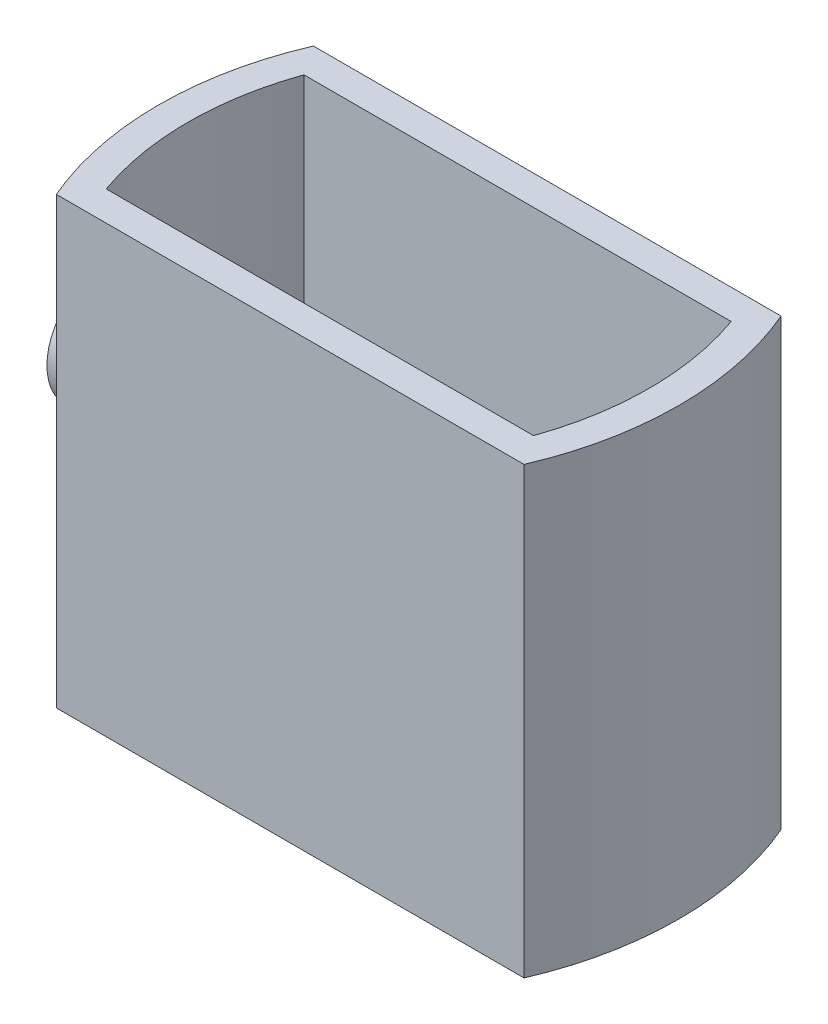
from build123d import *

# Parameters (mm, degrees)
SALIENTE_EXTRUIR1_DEPTH      = 45
SALIENTE_EXTRUIR2_DEPTH      = 3
SALIENTE_EXTRUIR3_REACH      = 75.192
SALIENTE_EXTRUIR3_END_RADIUS = 33
CROQUIS3_R                   = 6
SALIENTE_EXTRUIR4_START      = 5
CROQUIS4_R                   = 6
SALIENTE_EXTRUIR4_DEPTH      = 5
CROQUIS5_R                   = 3
CORTAR_EXTRUIR1_DEPTH        = 12


with BuildPart() as part:
    # Croquis1 → Saliente-Extruir1 (new body)
    with BuildSketch(Plane(origin=(0, 0, 0), x_dir=(1, 0, 0), z_dir=(0, 1, 0))):
        with BuildLine():
            Line((2.952769471, -3), (50.275773024, -3))
            ThreePointArc((50.275773024, -3), (52.944271247, 10), (50.275773024, 23))
            Line((50.275773024, 23), (2.952769471, 23))
            ThreePointArc((2.952769471, 23), (0.284271247, 10), (2.952769471, -3))
        make_face()
        with BuildLine():
            Line((5, 0), (48.228542495, 0))
            ThreePointArc((48.228542495, 0), (49.944271247, 10), (48.228542495, 20))
            Line((48.228542495, 20), (5, 20))
            ThreePointArc((5, 20), (3.284271247, 10), (5, 0))
        make_face(mode=Mode.SUBTRACT)
    extrude(amount=SALIENTE_EXTRUIR1_DEPTH)

    # Croquis2 → Saliente-Extruir2 (add)
    with BuildSketch(Plane.XZ):
        with BuildLine():
            Line((2.952769471, 3), (50.275773024, 3))
            ThreePointArc((50.275773024, 3), (52.944271247, -10), (50.275773024, -23))
            Line((50.275773024, -23), (2.952769471, -23))
            ThreePointArc((2.952769471, -23), (0.284271247, -10), (2.952769471, 3))
        make_face()
        with BuildLine():
            Line((15.114271247, -20), (38.114271247, -20))
            ThreePointArc((38.114271247, -20), (39.409874114, -10), (38.114271247, 0))
            Line((38.114271247, 0), (15.114271247, 0))
            ThreePointArc((15.114271247, 0), (13.398542495, -10), (15.114271247, -20))
        make_face(mode=Mode.SUBTRACT)
    extrude(amount=-SALIENTE_EXTRUIR2_DEPTH)

    # Saliente-Extruir3: up to this cylinder (the profile starts outside it)
    saliente_extruir3_end = Plane(origin=(33.284271247, 22.52988, -10), z_dir=(0, -1, 0)) * Cylinder(SALIENTE_EXTRUIR3_END_RADIUS, 217.384, mode=Mode.PRIVATE)
    # Croquis3 → Saliente-Extruir3 (add, up to the surface)
    with BuildSketch(Plane(origin=(0, 0, 0), x_dir=(0, 0, -1), z_dir=(1, 0, 0)), mode=Mode.PRIVATE) as saliente_extruir3_sk1:
        with Locations(Location((10, 22.52988005, 0), (0, 0, 180))):
            Circle(CROQUIS3_R)
    saliente_extruir3_tool1 = extrude(saliente_extruir3_sk1.sketch, amount=SALIENTE_EXTRUIR3_REACH, mode=Mode.PRIVATE) - saliente_extruir3_end
    add(saliente_extruir3_tool1.solids().sort_by_distance((0, 22.52988, -10))[0])

    # Croquis4 → Saliente-Extruir4 (add)
    with BuildSketch(Plane.ZY.offset(SALIENTE_EXTRUIR4_START)):
        with Locations((-10, 22.52988005)):
            Circle(CROQUIS4_R)
    extrude(amount=-SALIENTE_EXTRUIR4_DEPTH)

    # Croquis5 → Cortar-Extruir1 (cut)
    with BuildSketch(Plane.ZY.offset(5)):
        with Locations((-10, 22.52988005)):
            Circle(CROQUIS5_R)
    extrude(amount=-CORTAR_EXTRUIR1_DEPTH, mode=Mode.SUBTRACT)


solid = part.part
